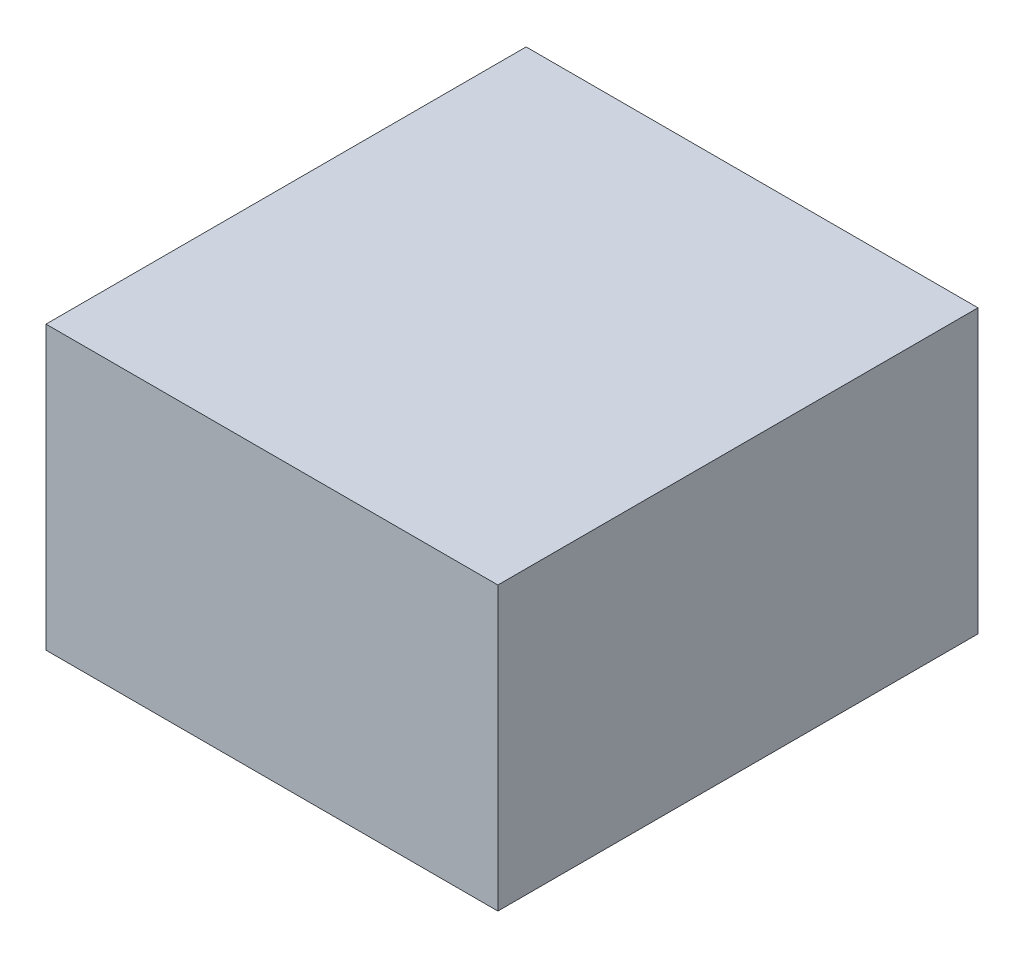
from build123d import *

# Parameters (mm, degrees)
SKETCH1_W           = 16
SKETCH1_H           = 17
BOSS_EXTRUDE1_DEPTH = 10


with BuildPart() as part:
    # Sketch1 → Boss-Extrude1 (new body)
    with BuildSketch(Plane(origin=(0, 0, 0), x_dir=(1, 0, 0), z_dir=(0, 1, 0))):
        with Locations((-8, -8.5)):
            Rectangle(SKETCH1_W, SKETCH1_H)
    extrude(amount=BOSS_EXTRUDE1_DEPTH)


solid = part.part
